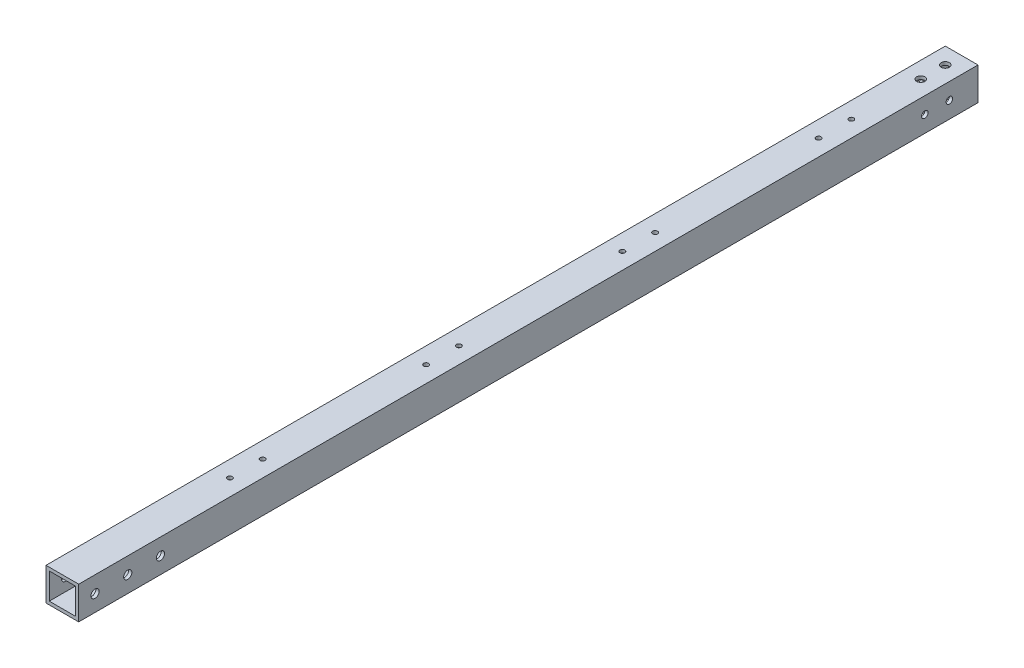
from build123d import *

# Parameters (mm, degrees)
SKETCH_1_W         = 20
SKETCH_1_H         = 20
SKETCH_1_W_2       = 16
SKETCH_1_H_2       = 16
EXTRUDE_1_DEPTH    = 550
SKETCH2_R          = 2.5
CUT_EXTRUDE2_DEPTH = 20
SKETCH3_R          = 2
CUT_EXTRUDE3_DEPTH = 20
SKETCH4_R          = 2.5
CUT_EXTRUDE4_DEPTH = 20
SKETCH6_R          = 1.5
CUT_EXTRUDE6_DEPTH = 20
LPATTERN1_COUNT    = 4
LPATTERN1_PITCH    = 120


with BuildPart() as part:
    # 草图1 → 凸台-拉伸1 (new body)
    with BuildSketch(Plane.XY):
        Rectangle(SKETCH_1_W, SKETCH_1_H)
        Rectangle(SKETCH_1_W_2, SKETCH_1_H_2, mode=Mode.SUBTRACT)
    extrude(amount=EXTRUDE_1_DEPTH)

    # Sketch2 → Cut-Extrude2 (cut)
    with BuildSketch(Plane.XZ.offset(10)):
        with Locations(Location((0, 10, 0), (0, 0, 270))):
            Circle(SKETCH2_R)
        with Locations(Location((0, 25, 0), (0, 0, 270))):
            Circle(SKETCH2_R)
    extrude(amount=-CUT_EXTRUDE2_DEPTH, mode=Mode.SUBTRACT)

    # Sketch3 → Cut-Extrude3 (cut)
    with BuildSketch(Plane.ZY.offset(10)):
        with Locations((17.5, 0)):
            Circle(SKETCH3_R)
        with Locations((32.5, 0)):
            Circle(SKETCH3_R)
    extrude(amount=-CUT_EXTRUDE3_DEPTH, mode=Mode.SUBTRACT)

    # Sketch4 → Cut-Extrude4 (cut)
    with BuildSketch(Plane(origin=(10, 0, 0), x_dir=(0, 0, -1), z_dir=(1, 0, 0))):
        with Locations((-540, 0)):
            Circle(SKETCH4_R)
        with Locations((-520, 0)):
            Circle(SKETCH4_R)
        with Locations((-500, 0)):
            Circle(SKETCH4_R)
    extrude(amount=-CUT_EXTRUDE4_DEPTH, mode=Mode.SUBTRACT)

    # Sketch6 → Cut-Extrude6 (cut)
    with BuildSketch(Plane.XZ.offset(10)):
        with Locations(Location((0, 67.5, 0), (0, 0, 270))):
            Circle(SKETCH6_R)
        with Locations(Location((0, 87.5, 0), (0, 0, 270))):
            Circle(SKETCH6_R)
    cut_extrude6 = extrude(amount=-CUT_EXTRUDE6_DEPTH, mode=Mode.SUBTRACT)

    # LPattern1: Cut-Extrude6 ×4
    with Locations(*[(0, 0, i * LPATTERN1_PITCH) for i in range(1, LPATTERN1_COUNT)]):
        add(cut_extrude6, mode=Mode.SUBTRACT)


solid = part.part
